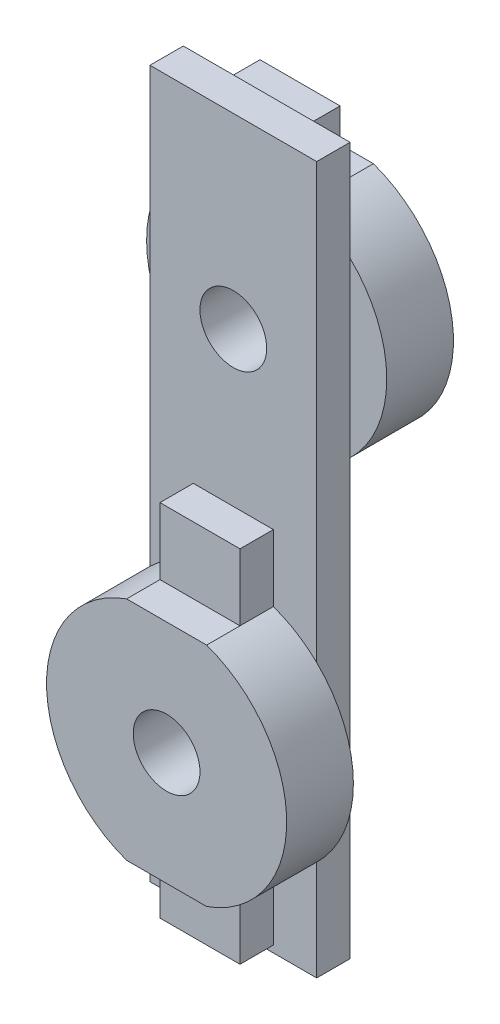
from build123d import *

# Parameters (mm, degrees)
SKETCH1_W           = 25
SKETCH1_H           = 106
BOSS_EXTRUDE1_DEPTH = 5
SKETCH2_R           = 5
BOSS_EXTRUDE3_DEPTH = 10
SKETCH4_R           = 5
BOSS_EXTRUDE4_DEPTH = 10
SKETCH5_R           = 5
CUT_EXTRUDE2_DEPTH  = 5
SKETCH6_W           = 12
SKETCH6_H           = 10
CUT_EXTRUDE3_DEPTH  = 5
SKETCH7_W           = 12
SKETCH7_H           = 10
CUT_EXTRUDE4_DEPTH  = 5


with BuildPart() as part:
    # Sketch1 → Boss-Extrude1 (new body)
    with BuildSketch(Plane.XY):
        with Locations((0, 3)):
            Rectangle(SKETCH1_W, SKETCH1_H)
    extrude(amount=BOSS_EXTRUDE1_DEPTH)

    # Sketch2 → Boss-Extrude3 (add)
    with BuildSketch(Plane.XY.offset(5)):
        with BuildLine():
            Line((6, 4.970562748), (-6, 4.970562748))
            Line((-6, 4.970562748), (-6, -5.029437252))
            ThreePointArc((-6, -5.029437252), (-18, -22), (-6, -38.970562748))
            Line((-6, -38.970562748), (-6, -48.970562748))
            Line((-6, -48.970562748), (6, -48.970562748))
            Line((6, -48.970562748), (6, -38.970562748))
            ThreePointArc((6, -38.970562748), (18, -22), (6, -5.029437252))
            Line((6, -5.029437252), (6, 4.970562748))
        make_face()
        with Locations((0, -22)):
            Circle(SKETCH2_R, mode=Mode.SUBTRACT)
    extrude(amount=BOSS_EXTRUDE3_DEPTH)

    # Sketch4 → Boss-Extrude4 (add)
    with BuildSketch(Plane(origin=(0, 0, 0), x_dir=(-1, 0, 0), z_dir=(0, 0, -1))):
        with BuildLine():
            Line((6, 54.970562748), (-6, 54.970562748))
            Line((-6, 54.970562748), (-6, 44.970562748))
            ThreePointArc((-6, 44.970562748), (-18, 28), (-6, 11.029437252))
            Line((-6, 11.029437252), (-6, 1.029437252))
            Line((-6, 1.029437252), (6, 1.029437252))
            Line((6, 1.029437252), (6, 11.029437252))
            ThreePointArc((6, 11.029437252), (18, 28), (6, 44.970562748))
            Line((6, 44.970562748), (6, 54.970562748))
        make_face()
        with Locations((0, 28)):
            Circle(SKETCH4_R, mode=Mode.SUBTRACT)
    extrude(amount=BOSS_EXTRUDE4_DEPTH)

    # Sketch5 → Cut-Extrude2 (cut)
    with BuildSketch(Plane(origin=(0, 0, 0), x_dir=(-1, 0, 0), z_dir=(0, 0, -1))):
        with Locations((0, 28)):
            Circle(SKETCH5_R)
        with Locations((0, -22)):
            Circle(SKETCH5_R)
    extrude(amount=-CUT_EXTRUDE2_DEPTH, mode=Mode.SUBTRACT)

    # Sketch6 → Cut-Extrude3 (cut)
    with BuildSketch(Plane(origin=(0, 0, -10), x_dir=(-1, 0, 0), z_dir=(0, 0, -1))):
        with Locations((0, 49.970562748)):
            Rectangle(SKETCH6_W, SKETCH6_H)
        with Locations((0, 6.029437252)):
            Rectangle(SKETCH6_W, SKETCH6_H)
    extrude(amount=-CUT_EXTRUDE3_DEPTH, mode=Mode.SUBTRACT)

    # Sketch7 → Cut-Extrude4 (cut)
    with BuildSketch(Plane.XY.offset(15)):
        with Locations((0, -0.029437252)):
            Rectangle(SKETCH7_W, SKETCH7_H)
        with Locations((0, -43.970562748)):
            Rectangle(SKETCH7_W, SKETCH7_H)
    extrude(amount=-CUT_EXTRUDE4_DEPTH, mode=Mode.SUBTRACT)


solid = part.part
